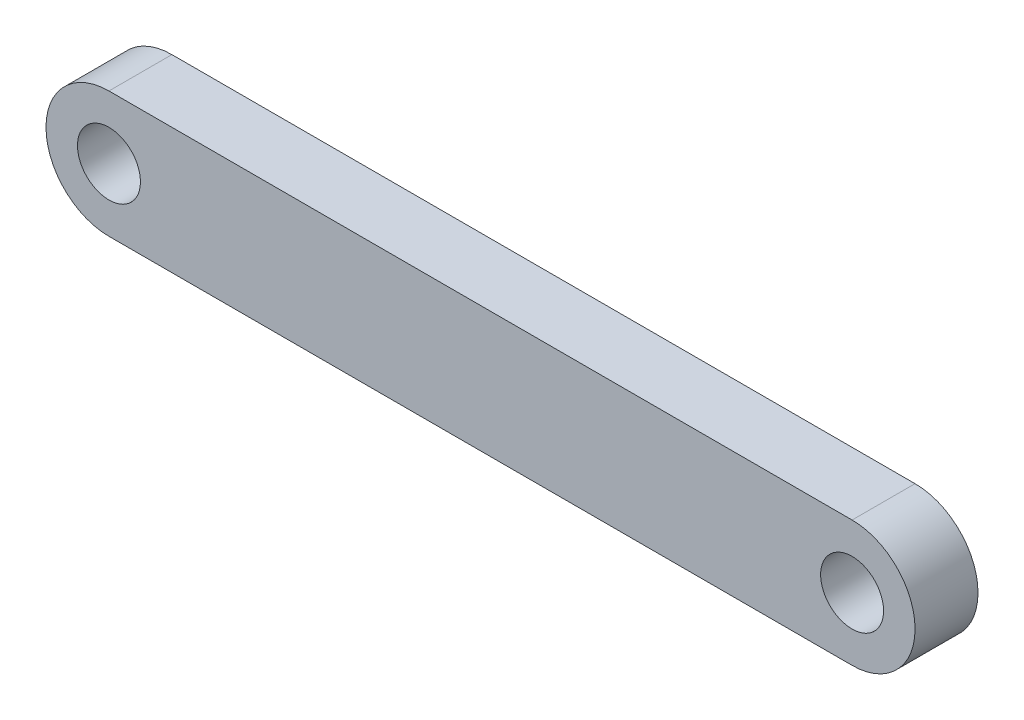
from build123d import *

# Parameters (mm, degrees)
SKETCH_1_R      = 1
EXTRUDE_1_DEPTH = 2


with BuildPart() as part:
    # 草圖1 → 填料-伸長1 (new body)
    with BuildSketch(Plane.XY):
        with BuildLine():
            Line((-11.804999984, 2.000609109), (11.805000016, 2.000609109))
            ThreePointArc((11.805000016, 2.000609109), (13.805000016, 0.000609109), (11.805000016, -1.999390891))
            Line((11.805000016, -1.999390891), (-11.804999984, -1.999390891))
            ThreePointArc((-11.804999984, -1.999390891), (-13.804999984, 0.000609109), (-11.804999984, 2.000609109))
        make_face()
        with Locations((-11.804999984, 0.000609109)):
            Circle(SKETCH_1_R, mode=Mode.SUBTRACT)
        with Locations((11.805000016, 0.000609109)):
            Circle(SKETCH_1_R, mode=Mode.SUBTRACT)
    extrude(amount=EXTRUDE_1_DEPTH)


solid = part.part
